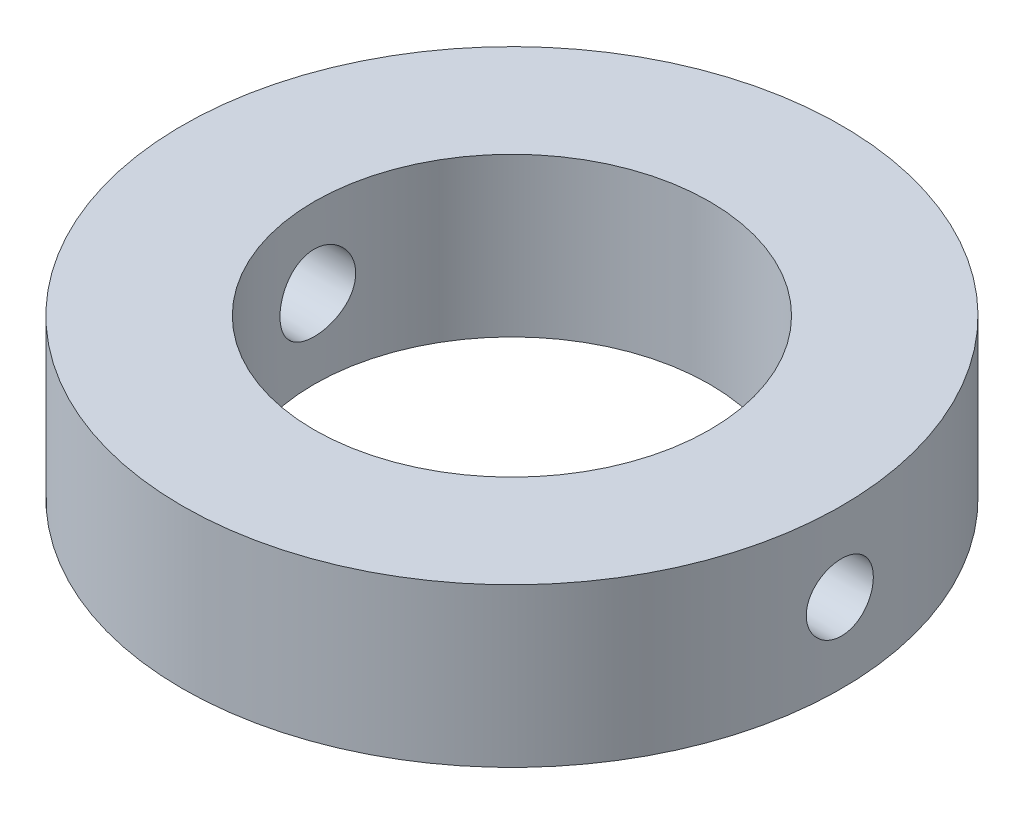
from build123d import *

# Parameters (mm, degrees)
SKETCH1_R           = 25
SKETCH1_R_2         = 15
BOSS_EXTRUDE1_DEPTH = 12
SCALE1_SCALE        = 0.33


with BuildPart() as part:
    # Sketch1 → Boss-Extrude1 (new body)
    with BuildSketch(Plane(origin=(0, 0, 0), x_dir=(1, 0, 0), z_dir=(0, 1, 0))):
        with Locations(Location((0, 0, 0), (0, 0, 270))):
            Circle(SKETCH1_R)
        with Locations(Location((0, 0, 0), (0, 0, 270))):
            Circle(SKETCH1_R_2, mode=Mode.SUBTRACT)
    extrude(amount=BOSS_EXTRUDE1_DEPTH)

    # Sketch2 → Cut-Revolve1 (revolve, cut)
    with BuildSketch(Plane.XY, mode=Mode.PRIVATE) as cut_revolve1_sk:
        Polygon((30, 8.5), (30, 6), (-30, 6), (-30, 9), align=None)
    revolve(cut_revolve1_sk.sketch.rotate(Axis((30, 6, 0), (-1, 0, 0)), 133.934111216), axis=Axis((30, 6, 0), (-1, 0, 0)), mode=Mode.SUBTRACT)


with BuildPart() as part_1:
    # Scale1: scaled about (0.080152948, 5.999999597, -1.2051e-05)
    add(part.part.scale(SCALE1_SCALE).moved(Location((0.053702475, 4.01999973, -8.074e-06))))


solid = part_1.part
